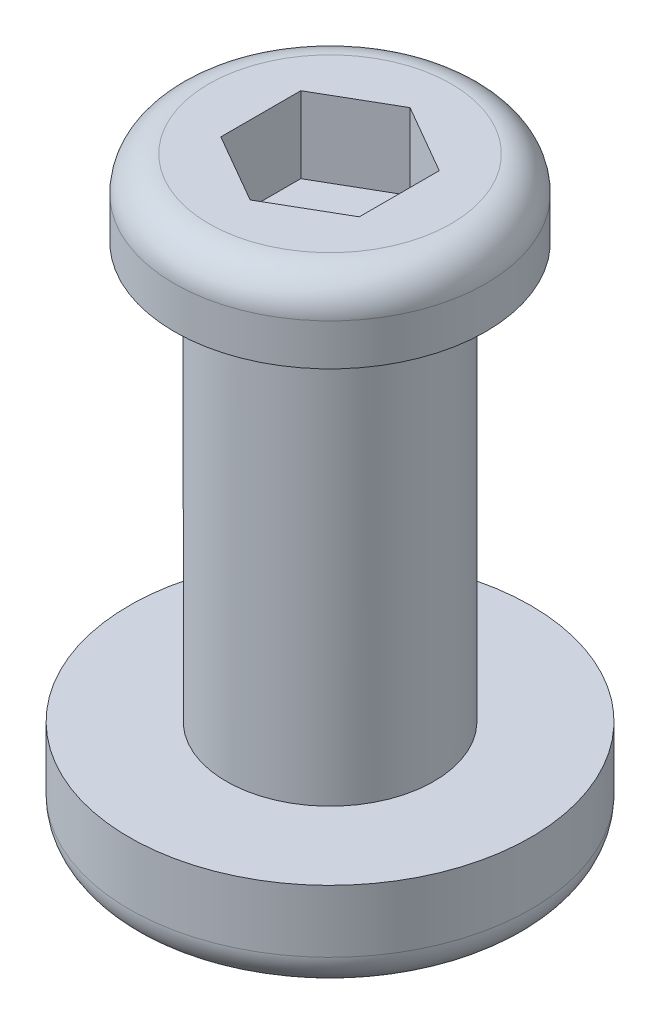
from build123d import *

# Parameters (mm, degrees)
SKETCH_1_R      = 1.5
EXTRUDE_1_DEPTH = 6
SKETCH_2_R      = 2.25
EXTRUDE_2_DEPTH = 1.1
SKETCH_3_R      = 2.9
EXTRUDE_3_DEPTH = 1.4
FILLET_1_R      = 0.5


with BuildPart() as part:
    # 草图1 → 凸台-拉伸1 (new body)
    with BuildSketch(Plane(origin=(0, 0, 0), x_dir=(1, 0, 0), z_dir=(0, 1, 0))):
        with Locations(Location((0, 0, 0), (0, 0, 270))):
            Circle(SKETCH_1_R)
    extrude(amount=EXTRUDE_1_DEPTH)

    # 草图2 → 凸台-拉伸2 (add)
    with BuildSketch(Plane(origin=(0, 6, 0), x_dir=(1, 0, 0), z_dir=(0, 1, 0))):
        with Locations(Location((0, 0, 0), (0, 0, 270))):
            Circle(SKETCH_2_R)
        Polygon((0, 1.154700538), (-1, 0.577350269), (-1, -0.577350269), (0, -1.154700538), (1, -0.577350269), (1, 0.577350269), align=None, mode=Mode.SUBTRACT)
    extrude(amount=EXTRUDE_2_DEPTH)

    # 草图3 → 凸台-拉伸3 (add)
    with BuildSketch(Plane.XZ):
        with Locations(Location((0, 0, 0), (0, 0, 270))):
            Circle(SKETCH_3_R)
        Polygon((0, 1.154700538), (-1, 0.577350269), (-1, -0.577350269), (0, -1.154700538), (1, -0.577350269), (1, 0.577350269), align=None, mode=Mode.SUBTRACT)
    extrude(amount=EXTRUDE_3_DEPTH)

    # 圆角1
    fillet_1_edges = [part.edges().sort_by_distance(p)[0] for p in [
        (0, 7.1, -2.25),
        (0, -1.4, 2.9),
    ]]
    fillet(fillet_1_edges, radius=FILLET_1_R)


solid = part.part
